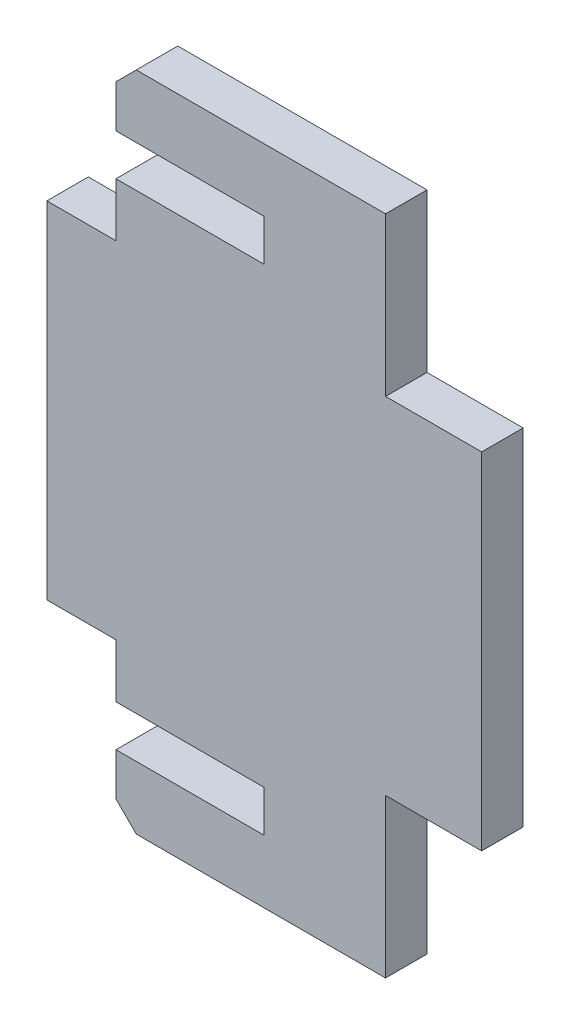
from build123d import *

# Parameters (mm, degrees)
BASE_EXTRUDE_DEPTH = 3


with BuildPart() as part:
    # Sketch1 → Base-Extrude (new body)
    with BuildSketch(Plane.XY):
        Polygon((628.807360223, -34.821043289), (628.807360223, -23.384768608), (635.760704602, -23.384768608), (635.760704602, 1.615231392), (628.807360223, 1.615231392), (628.807360223, 13.051506072), (610.77613174, 13.051506072), (609.307360223, 11.582734555), (609.307360223, 8.500342673), (620.002394878, 8.500342673), (620.006556706, 5.50034556), (609.307360223, 5.50034556), (609.307360223, 1.615231392), (604.307360223, 1.615231392), (604.307360223, -23.384768608), (609.307360223, -23.384768608), (609.307360223, -27.269882776), (620.006556706, -27.269882776), (620.002394878, -30.269879889), (609.307360223, -30.269879889), (609.307360223, -33.352271772), (610.77613174, -34.821043289), align=None)
    extrude(amount=-BASE_EXTRUDE_DEPTH)


solid = part.part
